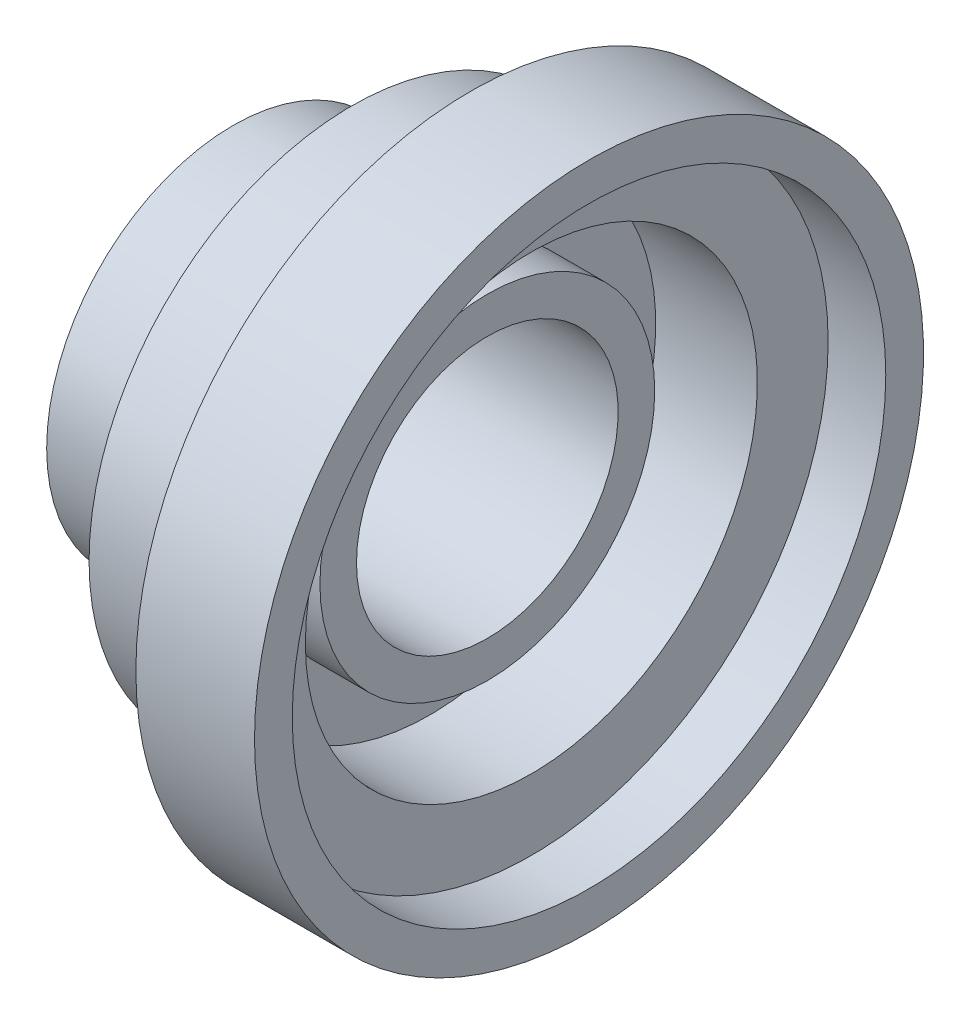
from build123d import *


with BuildPart() as part:
    # Croquis1 → Revolución1 (revolve)
    with BuildSketch(Plane.XY, mode=Mode.PRIVATE) as revoluci_n1_sk:
        Polygon((0, 0), (0, 16.40097141), (35, 16.40097141), (35, 38.90097141), (70, 38.90097141), (70, 60.089754962), (105, 60.089754962), (105, 48.950400909), (88, 48.950400909), (88, 28.083723598), (58, 28.083723598), (58, 10.791148393), (75, 10.791148393), (75, 0), align=None)
    revolve(revoluci_n1_sk.sketch.rotate(Axis((0, -38.59902859, 0), (1, 0, 0)), 90), axis=Axis((0, -38.59902859, 0), (1, 0, 0)))


solid = part.part
